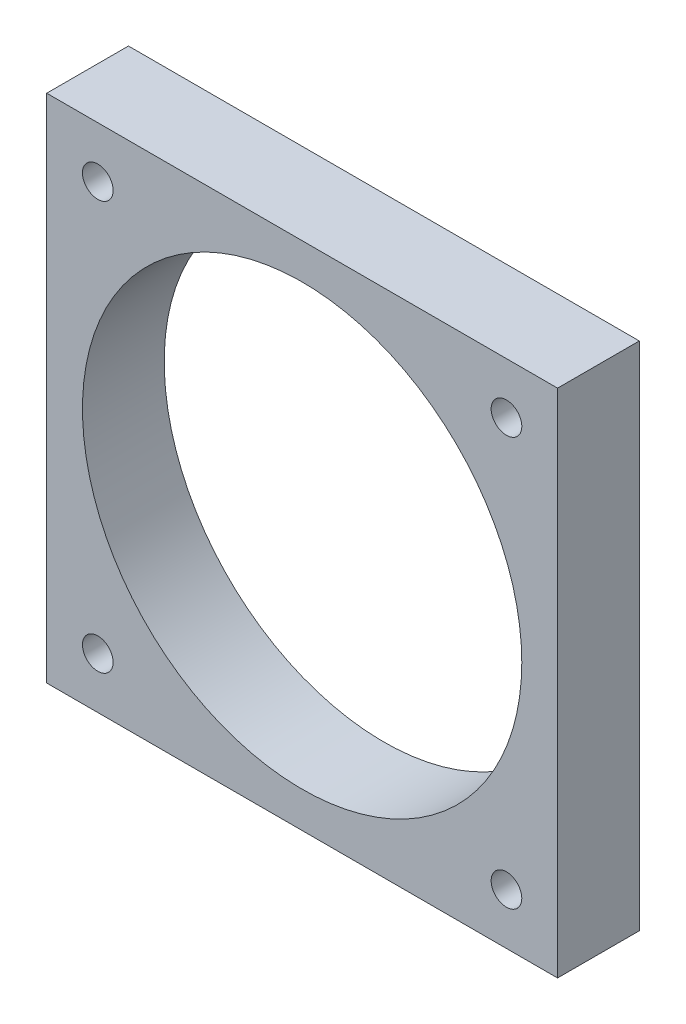
from build123d import *

# Parameters (mm, degrees)
SKETCH_1_W      = 50
SKETCH_1_H      = 50
SKETCH_1_R      = 21.5
SKETCH_1_R_2    = 1.5
EXTRUDE_1_DEPTH = 8


with BuildPart() as part:
    # 草图1 → 凸台-拉伸1 (new body)
    with BuildSketch(Plane.XY):
        Rectangle(SKETCH_1_W, SKETCH_1_H)
        Circle(SKETCH_1_R, mode=Mode.SUBTRACT)
        with Locations((-20, 20)):
            Circle(SKETCH_1_R_2, mode=Mode.SUBTRACT)
        with Locations(Location((20, 20, 0), (0, 0, 180))):
            Circle(SKETCH_1_R_2, mode=Mode.SUBTRACT)
        with Locations((20, -20)):
            Circle(SKETCH_1_R_2, mode=Mode.SUBTRACT)
        with Locations(Location((-20, -20, 0), (0, 0, 180))):
            Circle(SKETCH_1_R_2, mode=Mode.SUBTRACT)
    extrude(amount=EXTRUDE_1_DEPTH)


solid = part.part
